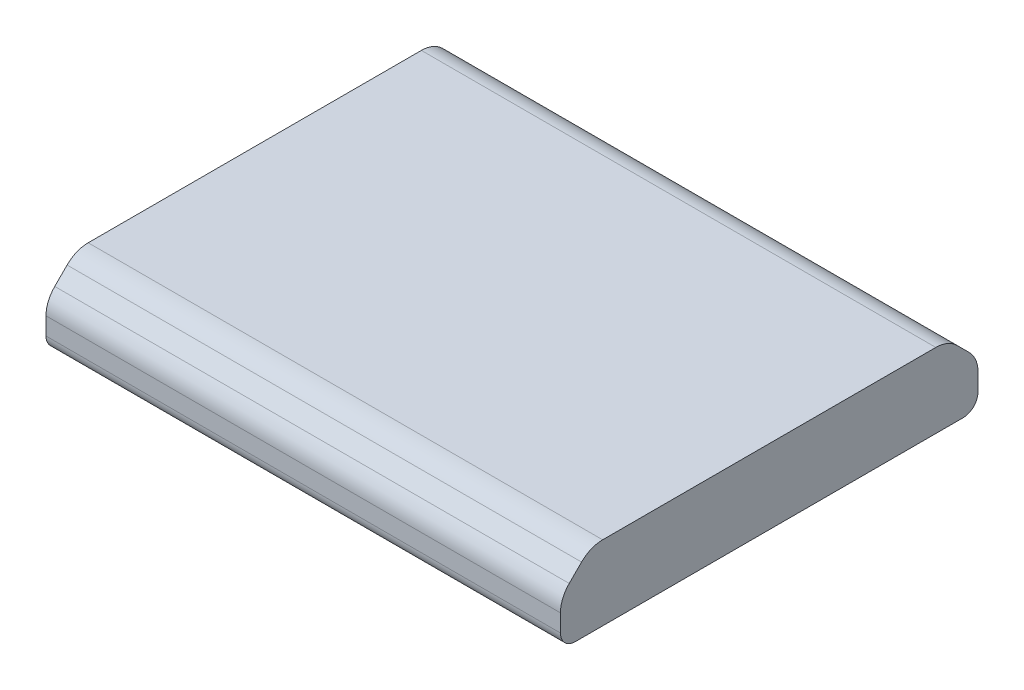
from build123d import *

# Parameters (mm, degrees)
BOSS_EXTRUDE1_START = -35
BOSS_EXTRUDE1_DEPTH = 69


with BuildPart() as part:
    # Sketch2 → Boss-Extrude1 (new body)
    with BuildSketch(Plane(origin=(0, 0, 0), x_dir=(0, 0, -1), z_dir=(1, 0, 0)).offset(BOSS_EXTRUDE1_START)):
        with BuildLine():
            Line((28, -13.656854249), (28, -16))
            ThreePointArc((28, -16), (27.414213562, -17.414213562), (26, -18))
            Line((26, -18), (-26, -18))
            ThreePointArc((-26, -18), (-27.414213562, -17.414213562), (-28, -16))
            Line((-28, -16), (-28, -13.656854249))
            ThreePointArc((-28, -13.656854249), (-27.69551813, -12.12612052), (-26.828427125, -10.828427125))
            Line((-26.828427125, -10.828427125), (-25.171572875, -9.171572875))
            ThreePointArc((-25.171572875, -9.171572875), (-23.87387948, -8.30448187), (-22.343145751, -8))
            Line((-22.343145751, -8), (22.343145751, -8))
            ThreePointArc((22.343145751, -8), (23.87387948, -8.30448187), (25.171572875, -9.171572875))
            Line((25.171572875, -9.171572875), (26.828427125, -10.828427125))
            ThreePointArc((26.828427125, -10.828427125), (27.69551813, -12.12612052), (28, -13.656854249))
        make_face()
    extrude(amount=BOSS_EXTRUDE1_DEPTH)


solid = part.part
